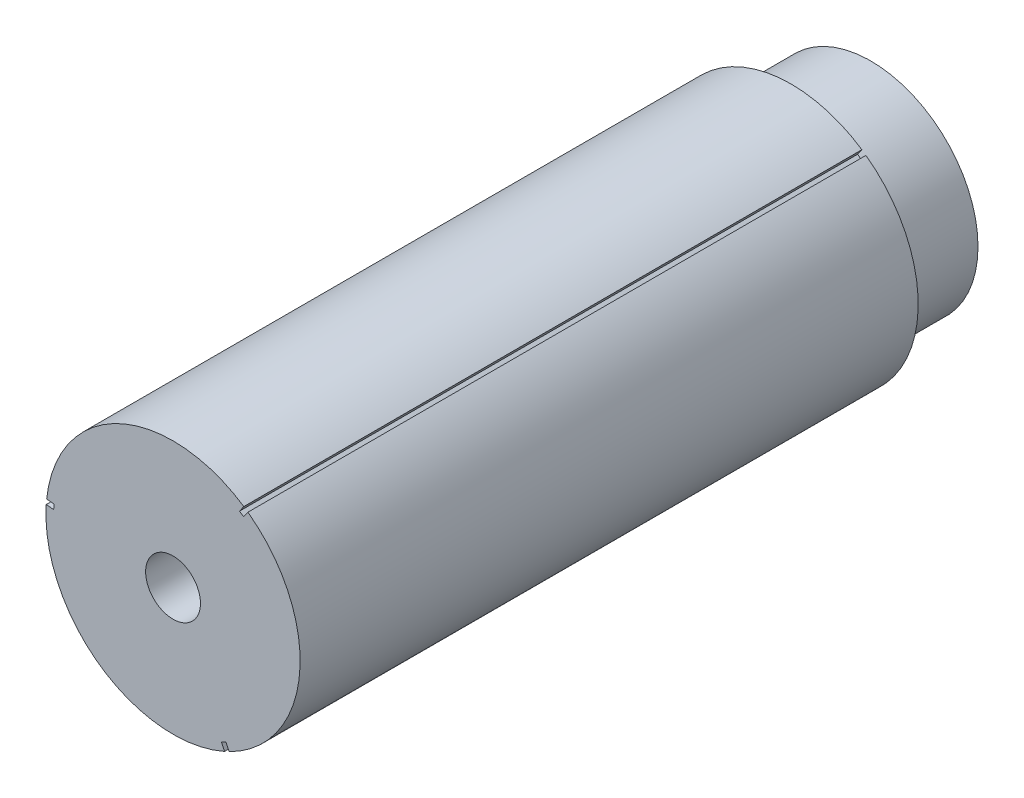
from build123d import *

# Parameters (mm, degrees)
ESQUISSE1_R             = 10.75
ESQUISSE1_R_2           = 2.75
BASE_EXTRUSION_DEPTH    = 8
ESQUISSE2_R             = 12.75
ESQUISSE2_R_2           = 2.75
BOSS_EXTRU_1_DEPTH      = 62
ENL_V_MAT_EXTRU_1_REACH = 74.285


with BuildPart() as part:
    # Esquisse1 → Base-Extrusion (new body)
    with BuildSketch(Plane.XY):
        Circle(ESQUISSE1_R)
        Circle(ESQUISSE1_R_2, mode=Mode.SUBTRACT)
    extrude(amount=BASE_EXTRUSION_DEPTH)

    # Esquisse2 → Boss.-Extru.1 (add)
    with BuildSketch(Plane.XY.offset(8)):
        Circle(ESQUISSE2_R)
        Circle(ESQUISSE2_R_2, mode=Mode.SUBTRACT)
    extrude(amount=BOSS_EXTRU_1_DEPTH)

    # Esquisse4 → Enlèv. mat.-Extru.1 (cut, up to next)
    with BuildSketch(Plane.XY.offset(70), mode=Mode.PRIVATE) as enl_v_mat_extru_1_sk1:
        with BuildLine():
            Line((7.158163625, 10.671606885), (6.672416375, 9.977041632))
            Line((6.672416375, 9.977041632), (7.082156576, 9.690488028))
            Line((7.082156576, 9.690488028), (7.567903827, 10.385053282))
            ThreePointArc((7.567903827, 10.385053282), (7.364427601, 10.530323172), (7.158163625, 10.671606885))
        make_face()
    enl_v_mat_extru_1_tool1 = extrude(enl_v_mat_extru_1_sk1.sketch, amount=-ENL_V_MAT_EXTRU_1_REACH, mode=Mode.PRIVATE) & part.part
    # Esquisse4 → Enlèv. mat.-Extru.1 (cut, up to next)
    with BuildSketch(Plane.XY.offset(70), mode=Mode.PRIVATE) as enl_v_mat_extru_1_sk2:
        with BuildLine():
            Line((5.662800849, -11.534954987), (5.30416332, -10.767002901))
            Line((5.30416332, -10.767002901), (4.851130519, -10.978571523))
            Line((4.851130519, -10.978571523), (5.209768049, -11.746523608))
            ThreePointArc((5.209768049, -11.746523608), (5.437313576, -11.642942973), (5.662800849, -11.534954987))
        make_face()
    enl_v_mat_extru_1_tool2 = extrude(enl_v_mat_extru_1_sk2.sketch, amount=-ENL_V_MAT_EXTRU_1_REACH, mode=Mode.PRIVATE) & part.part
    # Esquisse4 → Enlèv. mat.-Extru.1 (cut, up to next)
    with BuildSketch(Plane.XY.offset(70), mode=Mode.PRIVATE) as enl_v_mat_extru_1_sk3:
        with BuildLine():
            Line((-12.820964474, 0.863348101), (-11.976579695, 0.78996127))
            Line((-11.976579695, 0.78996127), (-11.933287096, 1.288083495))
            Line((-11.933287096, 1.288083495), (-12.777671875, 1.361470326))
            ThreePointArc((-12.777671875, 1.361470326), (-12.801741178, 1.112619801), (-12.820964474, 0.863348101))
        make_face()
    enl_v_mat_extru_1_tool3 = extrude(enl_v_mat_extru_1_sk3.sketch, amount=-ENL_V_MAT_EXTRU_1_REACH, mode=Mode.PRIVATE) & part.part
    add(enl_v_mat_extru_1_tool1.solids().sort_by_distance((7.120625, 10.181712, 70))[0], mode=Mode.SUBTRACT)
    add(enl_v_mat_extru_1_tool2.solids().sort_by_distance((5.257309, -11.257498, 70))[0], mode=Mode.SUBTRACT)
    add(enl_v_mat_extru_1_tool3.solids().sort_by_distance((-12.377934, 1.075786, 70))[0], mode=Mode.SUBTRACT)


solid = part.part
